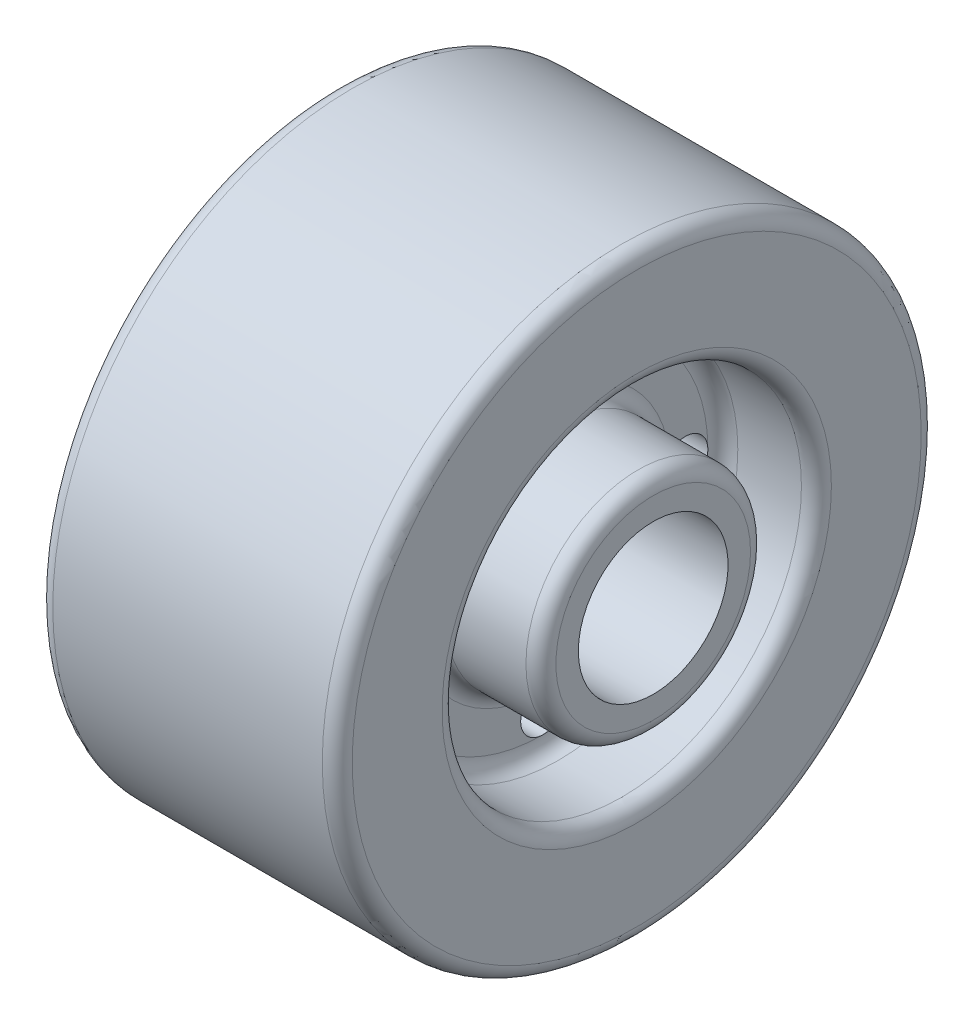
from build123d import *

# Parameters (mm, degrees)
FILLET1_R               = 2
SKETCH2_R               = 10
CENTREBORED_OUT_DEPTH   = 72.912168706
CUT_EXTRUDE2_DEPTH      = 10
CUT_EXTRUDE2_DEPTH_BACK = 20
SKETCH3_R               = 3
SKETCH4_R               = 6
CUT_EXTRUDE3_DEPTH      = 64.891235768


with BuildPart() as part:
    # Sketch1 → Revolve1 (revolve)
    with BuildSketch(Plane.XY, mode=Mode.PRIVATE) as revolve1_sk:
        Polygon((-20, -40), (20, -40), (20, -24), (7.5, -24), (7.5, -15), (22.2, -15), (22.2, -6), (-22.2, -6), (-22.2, -15), (-7.5, -15), (-7.5, -24), (-20, -24), align=None)
    revolve(revolve1_sk.sketch.rotate(Axis((0, 0, 0), (1, 0, 0)), 270), axis=Axis((0, 0, 0), (1, 0, 0)))

    # Fillet1
    fillet1_edges = [part.edges().sort_by_distance(p)[0] for p in [
        (-7.5, 0, -15),
        (-22.2, 0, -15),
        (22.2, 0, -15),
        (7.5, 0, -15),
        (7.5, 0, -24),
        (20, 0, -24),
        (20, 0, -40),
        (-20, 0, -40),
        (-20, 0, -24),
        (-7.5, 0, -24),
    ]]
    fillet(fillet1_edges, radius=FILLET1_R)

    # Sketch2 → centrebored out (cut, through all)
    with BuildSketch(Plane.ZY.offset(22.2)):
        Circle(SKETCH2_R)
    extrude(amount=-CENTREBORED_OUT_DEPTH, mode=Mode.SUBTRACT)

    # Sketch3 → Cut-Extrude2 (cut, two sides: drawn at the far end of the back side and taken through both)
    with BuildSketch(Plane.ZY.offset(7.5).offset(-CUT_EXTRUDE2_DEPTH_BACK)):
        with Locations(Location((0, 19, 0), (0, 0, 225.277753975))):
            Circle(SKETCH3_R)
        with Locations(Location((19, 0, 0), (0, 0, 135.277753979))):
            Circle(SKETCH3_R)
        with Locations(Location((0, -19, 0), (0, 0, 134.722246025))):
            Circle(SKETCH3_R)
        with Locations(Location((-19, 0, 0), (0, 0, 180))):
            Circle(SKETCH3_R)
    extrude(amount=CUT_EXTRUDE2_DEPTH + CUT_EXTRUDE2_DEPTH_BACK, mode=Mode.SUBTRACT)

    # Sketch4 → Cut-Extrude3 (cut, through all)
    with BuildSketch(Plane.ZY.offset(7.5)):
        with Locations((0, 19)):
            Circle(SKETCH4_R)
        with Locations((-19, 0)):
            Circle(SKETCH4_R)
        with Locations((19, 0)):
            Circle(SKETCH4_R)
        with Locations((0, -19)):
            Circle(SKETCH4_R)
    extrude(amount=CUT_EXTRUDE3_DEPTH, mode=Mode.SUBTRACT)


solid = part.part
